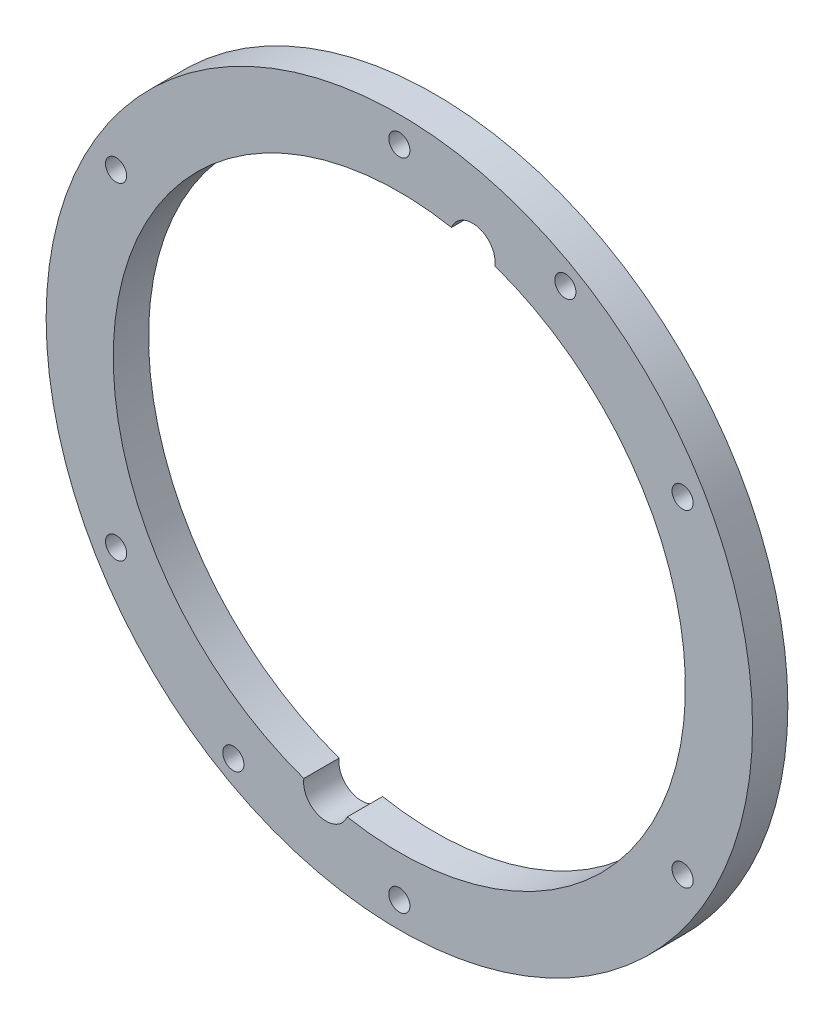
from build123d import *

# Parameters (mm, degrees)
ESQUISSE1_R        = 50
ESQUISSE1_R_2      = 1.5
BOSS_EXTRU_1_DEPTH = 5
SKETCH4_R          = 1.5
CUT_EXTRUDE4_DEPTH = 10
SKETCH5_R          = 40.5
CUT_EXTRUDE5_DEPTH = 10
SKETCH6_R          = 3.2
CUT_EXTRUDE6_DEPTH = 10


with BuildPart() as part:
    # Esquisse1 → Boss.-Extru.1 (new body)
    with BuildSketch(Plane.XY):
        Circle(ESQUISSE1_R)
        with Locations((-40.096976195, -23.15)):
            Circle(ESQUISSE1_R_2, mode=Mode.SUBTRACT)
        with Locations((-40.096976195, 23.15)):
            Circle(ESQUISSE1_R_2, mode=Mode.SUBTRACT)
        with Locations((0, 46.3)):
            Circle(ESQUISSE1_R_2, mode=Mode.SUBTRACT)
        with Locations((40.096976195, 23.15)):
            Circle(ESQUISSE1_R_2, mode=Mode.SUBTRACT)
        with Locations((40.096976195, -23.15)):
            Circle(ESQUISSE1_R_2, mode=Mode.SUBTRACT)
        with Locations((0, -46.3)):
            Circle(ESQUISSE1_R_2, mode=Mode.SUBTRACT)
    extrude(amount=BOSS_EXTRU_1_DEPTH)

    # Sketch4 → Cut-Extrude4 (cut)
    with BuildSketch(Plane.XY.offset(5)):
        with Locations((-23.5, -40.703193978)):
            Circle(SKETCH4_R)
        with Locations((23.5, 40.703193978)):
            Circle(SKETCH4_R)
    extrude(amount=-CUT_EXTRUDE4_DEPTH, mode=Mode.SUBTRACT)

    # Sketch5 → Cut-Extrude5 (cut)
    with BuildSketch(Plane.XY.offset(5)):
        Circle(SKETCH5_R)
    extrude(amount=-CUT_EXTRUDE5_DEPTH, mode=Mode.SUBTRACT)

    # Sketch6 → Cut-Extrude6 (cut)
    with BuildSketch(Plane.XY.offset(5)):
        with Locations((10.352761804, 38.637033052)):
            Circle(SKETCH6_R)
        with Locations((-10.352761804, -38.637033052)):
            Circle(SKETCH6_R)
    extrude(amount=-CUT_EXTRUDE6_DEPTH, mode=Mode.SUBTRACT)


solid = part.part
